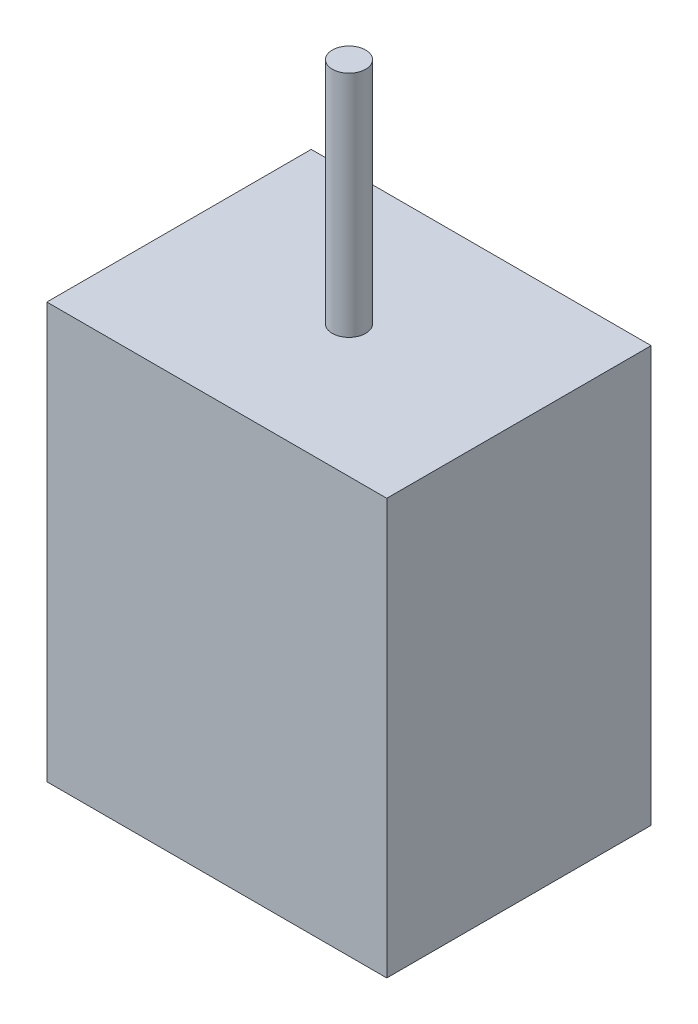
from build123d import *

# Parameters (mm, degrees)
SKETCH1_W           = 15.3
SKETCH1_H           = 11.9
SKETCH1_R           = 0.75
BOSS_EXTRUDE1_DEPTH = 18.7
SKETCH1_4_R         = 0.75
BOSS_EXTRUDE2_DEPTH = 29


with BuildPart() as part:
    # Sketch1 → Boss-Extrude1 (new body)
    with BuildSketch(Plane(origin=(0, 0, 0), x_dir=(1, 0, 0), z_dir=(0, 1, 0))):
        Rectangle(SKETCH1_W, SKETCH1_H)
        Circle(SKETCH1_R, mode=Mode.SUBTRACT)
    extrude(amount=BOSS_EXTRUDE1_DEPTH)

    # Sketch1<4> → Boss-Extrude2 (add)
    with BuildSketch(Plane(origin=(0, 0, 0), x_dir=(1, 0, 0), z_dir=(0, 1, 0))):
        Circle(SKETCH1_4_R)
    extrude(amount=BOSS_EXTRUDE2_DEPTH)


solid = part.part
